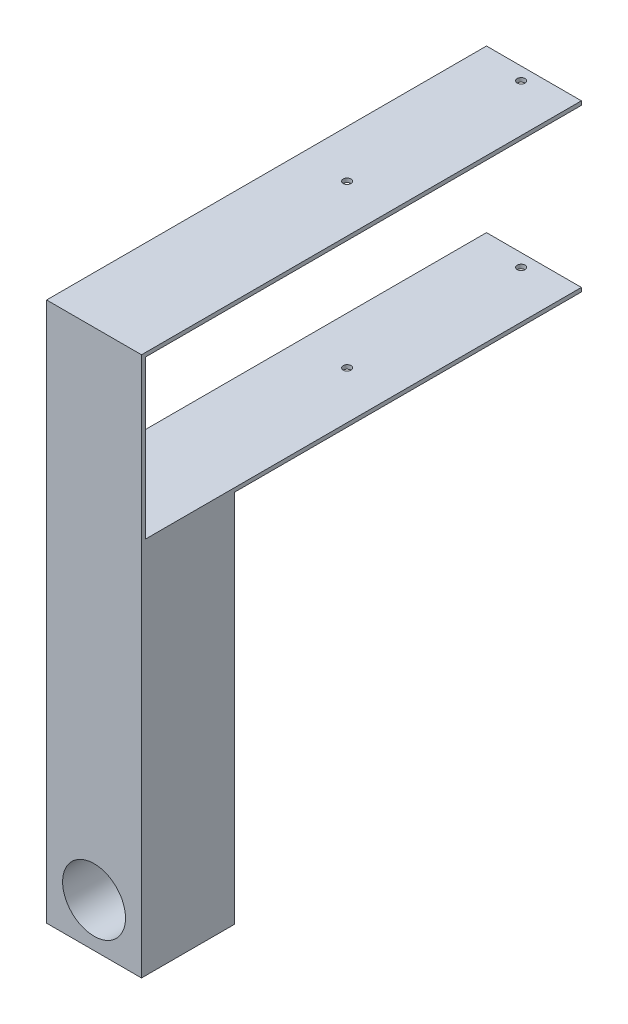
from build123d import *

# Parameters (mm, degrees)
SKETCH1_W           = 3870.96
SKETCH1_H           = 22014.18
BOSS_EXTRUDE1_DEPTH = 161.29
SKETCH2_W           = 3870.96
SKETCH2_H           = 17780
BOSS_EXTRUDE2_DEPTH = 161.29
SKETCH3_W           = 3870.96
SKETCH3_H           = 17780
BOSS_EXTRUDE3_DEPTH = 161.29
SKETCH4_W           = 3870.96
SKETCH4_H           = 3709.67
BOSS_EXTRUDE4_DEPTH = 15261.336
SKETCH5_R           = 161.29
CUT_EXTRUDE1_DEPTH  = 12848.844
SKETCH7_R           = 1282.7
CUT_EXTRUDE2_DEPTH  = 21138.454907405
SCALE1_SCALE        = 0.039370079


with BuildPart() as part:
    # Sketch1 → Boss-Extrude1 (new body)
    with BuildSketch(Plane.XY):
        Rectangle(SKETCH1_W, SKETCH1_H)
    extrude(amount=BOSS_EXTRUDE1_DEPTH)

    # Sketch2 → Boss-Extrude2 (add)
    with BuildSketch(Plane(origin=(0, 11007.09, 0), x_dir=(1, 0, 0), z_dir=(0, 1, 0))):
        with Locations((0, 8890)):
            Rectangle(SKETCH2_W, SKETCH2_H)
    extrude(amount=-BOSS_EXTRUDE2_DEPTH)

    # Sketch3 → Boss-Extrude3 (add)
    with BuildSketch(Plane(origin=(0, 4415.536, 0), x_dir=(1, 0, 0), z_dir=(0, 1, 0))):
        with Locations((0, 8890)):
            Rectangle(SKETCH3_W, SKETCH3_H)
    extrude(amount=-BOSS_EXTRUDE3_DEPTH)

    # Sketch4 → Boss-Extrude4 (add)
    with BuildSketch(Plane.XZ.offset(-4254.246)):
        with Locations((0, -1786.014661267)):
            Rectangle(SKETCH4_W, SKETCH4_H)
    extrude(amount=BOSS_EXTRUDE4_DEPTH)

    # Sketch5 → Cut-Extrude1 (cut)
    with BuildSketch(Plane(origin=(0, 11007.09, 0), x_dir=(1, 0, 0), z_dir=(0, 1, 0))):
        with Locations(Location((0, 17258.03, 0), (0, 0, 270))):
            Circle(SKETCH5_R)
        with Locations(Location((0, 10161.27, 0), (0, 0, 270))):
            Circle(SKETCH5_R)
    extrude(amount=-CUT_EXTRUDE1_DEPTH, mode=Mode.SUBTRACT)

    # Sketch7 → Cut-Extrude2 (cut, through all)
    with BuildSketch(Plane.XY.offset(161.29)):
        with Locations((0, -9216.39)):
            Circle(SKETCH7_R)
    extrude(amount=-CUT_EXTRUDE2_DEPTH, mode=Mode.SUBTRACT)


with BuildPart() as part_1:
    # Scale1: scaled about (0, -1625.758634815, -2390.119236931)
    add(part.part.scale(SCALE1_SCALE).moved(Location((0, -1561.75238935, -2296.020054375))))


solid = part_1.part
